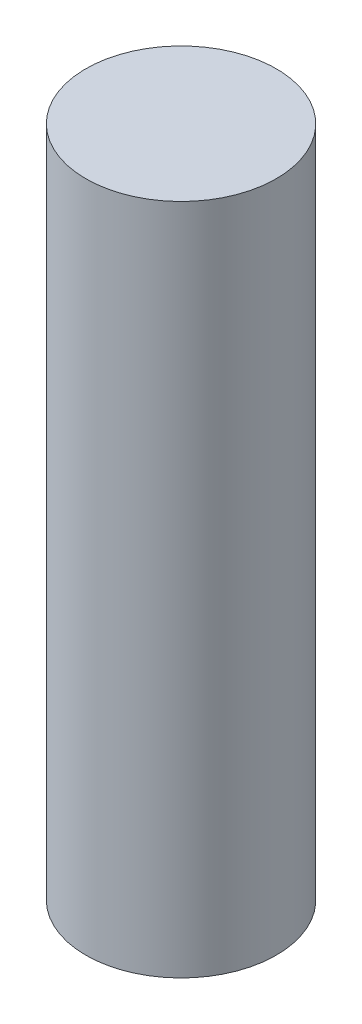
from build123d import *

# Parameters (mm, degrees)
SKETCH1_R           = 8.5
BOSS_EXTRUDE1_DEPTH = 60


with BuildPart() as part:
    # Sketch1 → Boss-Extrude1 (new body)
    with BuildSketch(Plane(origin=(0, 0, 0), x_dir=(1, 0, 0), z_dir=(0, 1, 0))):
        with Locations(Location((0, 0, 0), (0, 0, 270))):
            Circle(SKETCH1_R)
    extrude(amount=BOSS_EXTRUDE1_DEPTH)


solid = part.part
